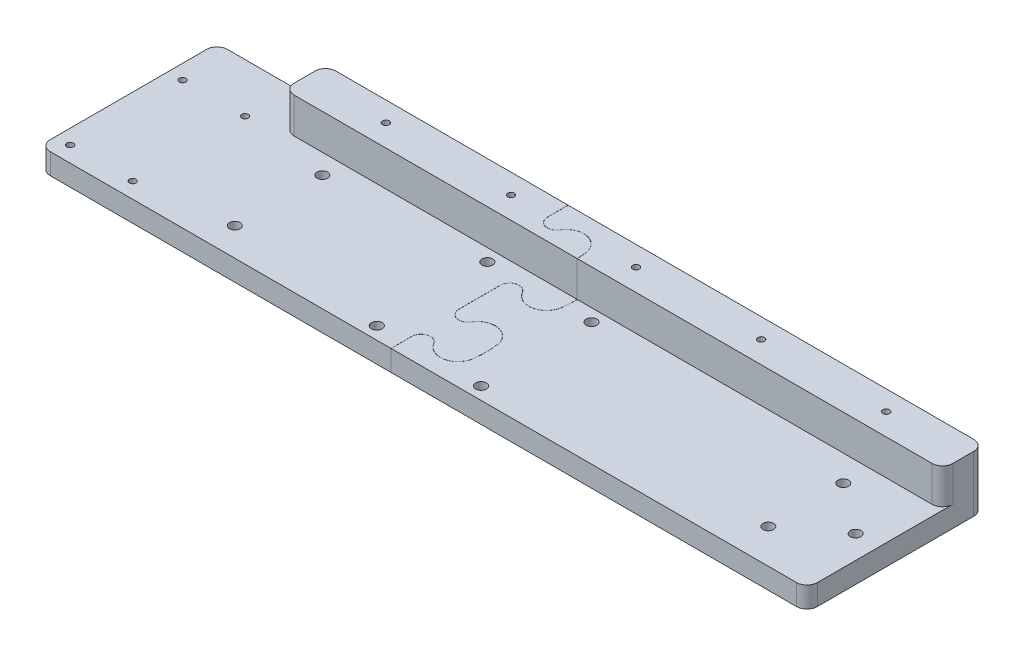
from build123d import *

# Parameters (mm, degrees)
SKETCH1_W                                    = 368
SKETCH1_H                                    = 85
BOSS_EXTRUDE1_DEPTH                          = 6
SKETCH2_W                                    = 316
SKETCH2_H                                    = 20
BOSS_EXTRUDE3_DEPTH                          = 17
CUT_EXTRUDE1_DEPTH                           = 379.071421824
CUT_EXTRUDE1_DEPTH_BACK                      = 379.071421824
SKETCH3_R                                    = 1.575
SKETCH3_R_2                                  = 2.55
SKETCH3_R_3                                  = 1.6
SKETCH4_W                                    = 368
SKETCH4_H                                    = 85
SKETCH4_R                                    = 3.575
SKETCH4_R_2                                  = 5.075
BOSS_EXTRUDE4_DEPTH                          = 4
FILLET1_R                                    = 5
WEIRD_CUT_DEPTH                              = 379.652875336
WEIRD_CUT_DEPTH_BACK                         = 379.652875336
IF_YOU_NO_STAY_I_MAKE_U_STAI_BREH_DEPTH      = 379.071421824
IF_YOU_NO_STAY_I_MAKE_U_STAI_BREH_DEPTH_BACK = 379.071421824
SKETCH8_R                                    = 2.575
YUH_DEPTH                                    = 379.652875336
YUH_DEPTH_BACK                               = 4
SKETCH9_R                                    = 5.075


with BuildPart() as part:
    # Sketch1 → Boss-Extrude1 (new body)
    with BuildSketch(Plane(origin=(0, 0, 0), x_dir=(1, 0, 0), z_dir=(0, 1, 0))):
        with Locations((184, 42.5)):
            Rectangle(SKETCH1_W, SKETCH1_H)
    extrude(amount=BOSS_EXTRUDE1_DEPTH)

    # Sketch2 → Boss-Extrude3 (add)
    with BuildSketch(Plane(origin=(0, 6, 0), x_dir=(1, 0, 0), z_dir=(0, 1, 0))):
        with Locations((210, 75)):
            Rectangle(SKETCH2_W, SKETCH2_H)
    extrude(amount=BOSS_EXTRUDE3_DEPTH)

    # Sketch3 → Cut-Extrude1 (cut, two sides: drawn at the far end of the back side and taken through both)
    with BuildSketch(Plane(origin=(0, 6, 0), x_dir=(1, 0, 0), z_dir=(0, 1, 0)).offset(-CUT_EXTRUDE1_DEPTH_BACK)):
        with Locations(Location((7, 61.45, 0), (0, 0, 270))):
            Circle(SKETCH3_R)
        with Locations(Location((7, 7.55, 0), (0, 0, 270))):
            Circle(SKETCH3_R)
        with Locations(Location((37, 7.55, 0), (0, 0, 270))):
            Circle(SKETCH3_R)
        with Locations(Location((37, 61.45, 0), (0, 0, 270))):
            Circle(SKETCH3_R)
        with Locations(Location((80, 55.5, 0), (0, 0, 270))):
            Circle(SKETCH3_R_2)
        with Locations(Location((80, 13.5, 0), (0, 0, 270))):
            Circle(SKETCH3_R_2)
        with Locations(Location((332.951144342, 52.487064273, 0), (0, 0, 270))):
            Circle(SKETCH3_R_2)
        with Locations(Location((356.848090273, 34.505122955, 0), (0, 0, 270))):
            Circle(SKETCH3_R_2)
        with Locations(Location((332.951144342, 16.523181637, 0), (0, 0, 270))):
            Circle(SKETCH3_R_2)
        with Locations(Location((90.5, 75.5, 0), (0, 0, 270))):
            Circle(SKETCH3_R_3)
        with Locations(Location((150.5, 75.5, 0), (0, 0, 270))):
            Circle(SKETCH3_R_3)
        with Locations(Location((210.5, 75.5, 0), (0, 0, 270))):
            Circle(SKETCH3_R_3)
        with Locations(Location((270.5, 75.5, 0), (0, 0, 270))):
            Circle(SKETCH3_R_3)
        with Locations(Location((330.5, 75.5, 0), (0, 0, 270))):
            Circle(SKETCH3_R_3)
    extrude(amount=CUT_EXTRUDE1_DEPTH + CUT_EXTRUDE1_DEPTH_BACK, mode=Mode.SUBTRACT)

    # Sketch4 → Boss-Extrude4 (add)
    with BuildSketch(Plane.XZ):
        with Locations((184, -42.5)):
            Rectangle(SKETCH4_W, SKETCH4_H)
        with Locations(Location((7, -7.55, 0), (0, 0, 270))):
            Circle(SKETCH4_R, mode=Mode.SUBTRACT)
        with Locations(Location((37, -7.55, 0), (0, 0, 270))):
            Circle(SKETCH4_R, mode=Mode.SUBTRACT)
        with Locations(Location((80, -13.5, 0), (0, 0, 270))):
            Circle(SKETCH4_R_2, mode=Mode.SUBTRACT)
        with Locations(Location((80, -55.5, 0), (0, 0, 270))):
            Circle(SKETCH4_R_2, mode=Mode.SUBTRACT)
        with Locations(Location((37, -61.45, 0), (0, 0, 270))):
            Circle(SKETCH4_R, mode=Mode.SUBTRACT)
        with Locations(Location((7, -61.45, 0), (0, 0, 270))):
            Circle(SKETCH4_R, mode=Mode.SUBTRACT)
        with Locations(Location((90.5, -75.5, 0), (0, 0, 270))):
            Circle(SKETCH4_R, mode=Mode.SUBTRACT)
        with Locations(Location((150.5, -75.5, 0), (0, 0, 270))):
            Circle(SKETCH4_R, mode=Mode.SUBTRACT)
        with Locations(Location((210.5, -75.5, 0), (0, 0, 270))):
            Circle(SKETCH4_R, mode=Mode.SUBTRACT)
        with Locations(Location((270.5, -75.5, 0), (0, 0, 270))):
            Circle(SKETCH4_R, mode=Mode.SUBTRACT)
        with Locations(Location((330.5, -75.5, 0), (0, 0, 270))):
            Circle(SKETCH4_R, mode=Mode.SUBTRACT)
        with Locations(Location((332.951144342, -52.487064273, 0), (0, 0, 270))):
            Circle(SKETCH4_R_2, mode=Mode.SUBTRACT)
        with Locations(Location((356.848090273, -34.505122955, 0), (0, 0, 270))):
            Circle(SKETCH4_R_2, mode=Mode.SUBTRACT)
        with Locations(Location((332.951144342, -16.523181637, 0), (0, 0, 270))):
            Circle(SKETCH4_R_2, mode=Mode.SUBTRACT)
    extrude(amount=BOSS_EXTRUDE4_DEPTH)

    # Fillet1
    fillet1_edges = [part.edges().sort_by_distance(p)[0] for p in [
        (52, 14.5, -85),
        (52, 14.5, -65),
        (368, 14.5, -65),
        (0, 1, -85),
        (368, 9.5, -85),
        (368, 1, 0),
        (0, 1, 0),
    ]]
    fillet(fillet1_edges, radius=FILLET1_R)

    # Sketch7 → Weird Cut (cut, two sides: drawn at the far end of the back side and taken through both)
    with BuildSketch(Plane.XZ.offset(4).offset(-WEIRD_CUT_DEPTH_BACK)):
        with BuildLine():
            Line((168.429742835, -9.968718608), (168.429742835, 0))
            Line((168.429742835, 0), (168.479742835, 0))
            Line((168.479742835, 0), (168.479742835, -9.968718608))
            ThreePointArc((168.479742835, -9.968718608), (171.739946469, -14.241172009), (176.721509375, -12.224536988))
            ThreePointArc((176.721509375, -12.224536988), (185.762309536, -8.235133349), (192.458717923, -15.502149495))
            ThreePointArc((192.458717923, -15.502149495), (192.814540004, -21.25), (192.458717923, -26.997850505))
            ThreePointArc((192.458717923, -26.997850505), (185.762309536, -34.264866651), (176.721509375, -30.275463012))
            ThreePointArc((176.721509375, -30.275463012), (171.739946469, -28.258827991), (168.479742835, -32.531281392))
            Line((168.479742835, -32.531281392), (168.479742835, -52.468718608))
            ThreePointArc((168.479742835, -52.468718608), (171.739946469, -56.741172009), (176.721509375, -54.724536988))
            ThreePointArc((176.721509375, -54.724536988), (185.762309536, -50.735133349), (192.458717923, -58.002149495))
            ThreePointArc((192.458717923, -58.002149495), (192.814540004, -63.75), (192.458717923, -69.497850505))
            ThreePointArc((192.458717923, -69.497850505), (185.762309536, -76.764866651), (176.721509375, -72.775463012))
            ThreePointArc((176.721509375, -72.775463012), (171.739946469, -70.758827991), (168.479742835, -75.031281392))
            Line((168.479742835, -75.031281392), (168.479742835, -85))
            Line((168.479742835, -85), (168.429742835, -85))
            Line((168.429742835, -85), (168.429742835, -75.031281392))
            ThreePointArc((168.429742835, -75.031281392), (171.726746686, -70.710601797), (176.764540004, -72.75))
            ThreePointArc((176.764540004, -72.75), (185.752114723, -76.715917026), (192.409099686, -69.491683614))
            ThreePointArc((192.409099686, -69.491683614), (192.764540004, -63.75), (192.409099686, -58.008316386))
            ThreePointArc((192.409099686, -58.008316386), (185.752114723, -50.784082974), (176.764540004, -54.75))
            ThreePointArc((176.764540004, -54.75), (171.726746686, -56.789398203), (168.429742835, -52.468718608))
            Line((168.429742835, -52.468718608), (168.429742835, -32.531281392))
            ThreePointArc((168.429742835, -32.531281392), (171.726746686, -28.210601797), (176.764540004, -30.25))
            ThreePointArc((176.764540004, -30.25), (185.752114723, -34.215917026), (192.409099686, -26.991683614))
            ThreePointArc((192.409099686, -26.991683614), (192.764540004, -21.25), (192.409099686, -15.508316386))
            ThreePointArc((192.409099686, -15.508316386), (185.752114723, -8.284082974), (176.764540004, -12.25))
            ThreePointArc((176.764540004, -12.25), (171.726746686, -14.289398203), (168.429742835, -9.968718608))
        make_face()
    extrude(amount=WEIRD_CUT_DEPTH + WEIRD_CUT_DEPTH_BACK, mode=Mode.SUBTRACT)


with BuildPart() as weird_cut_piece_1:
    # of the separate pieces the step leaves, piece 1, a body of its own (weird_cut_pieces)
    add(part.part.solids().sort_by_distance((168.479742835, -4, 0))[0])


with BuildPart() as weird_cut_piece_2:
    # of the separate pieces the step leaves, piece 2, a body of its own (weird_cut_pieces)
    add(part.part.solids().sort_by_distance((5, 6, 0))[0])


with BuildPart() as if_you_no_stay_i_make_u_stai_breh_tool:
    # Sketch8 → If you no stay i make u stai breh (new, two sides: drawn at the far end of the back side and taken through both)
    with BuildSketch(Plane(origin=(0, 6, 0), x_dir=(1, 0, 0), z_dir=(0, 1, 0)).offset(-IF_YOU_NO_STAY_I_MAKE_U_STAI_BREH_DEPTH_BACK)):
        with Locations(Location((205.64714142, 59, 0), (0, 0, 90))):
            Circle(SKETCH8_R)
        with Locations(Location((155.64714142, 59, 0), (0, 0, 90))):
            Circle(SKETCH8_R)
        with Locations(Location((205.64714142, 6, 0), (0, 0, 90))):
            Circle(SKETCH8_R)
        with Locations(Location((155.64714142, 6, 0), (0, 0, 90))):
            Circle(SKETCH8_R)
    extrude(amount=IF_YOU_NO_STAY_I_MAKE_U_STAI_BREH_DEPTH + IF_YOU_NO_STAY_I_MAKE_U_STAI_BREH_DEPTH_BACK)


with BuildPart() as weird_cut_piece_1_1:
    add(weird_cut_piece_1.part)

    # If you no stay i make u stai breh: cut by if_you_no_stay_i_make_u_stai_breh_tool
    add(if_you_no_stay_i_make_u_stai_breh_tool.part, mode=Mode.SUBTRACT)


with BuildPart() as weird_cut_piece_2_1:
    add(weird_cut_piece_2.part)

    # If you no stay i make u stai breh: cut by if_you_no_stay_i_make_u_stai_breh_tool
    add(if_you_no_stay_i_make_u_stai_breh_tool.part, mode=Mode.SUBTRACT)


with BuildPart() as yuh_tool:
    # Sketch9 → yuh (new, two sides: drawn at the far end of the back side and taken through both)
    with BuildSketch(Plane.XZ.offset(4).offset(-YUH_DEPTH_BACK)):
        with Locations(Location((155.64714142, -6, 0), (0, 0, 270))):
            Circle(SKETCH9_R)
        with Locations(Location((205.64714142, -6, 0), (0, 0, 270))):
            Circle(SKETCH9_R)
        with Locations(Location((205.64714142, -59, 0), (0, 0, 270))):
            Circle(SKETCH9_R)
        with Locations(Location((155.64714142, -59, 0), (0, 0, 270))):
            Circle(SKETCH9_R)
    extrude(amount=YUH_DEPTH + YUH_DEPTH_BACK)


with BuildPart() as weird_cut_piece_1_2:
    add(weird_cut_piece_1_1.part)

    # yuh: cut by yuh_tool
    add(yuh_tool.part, mode=Mode.SUBTRACT)


with BuildPart() as weird_cut_piece_2_2:
    add(weird_cut_piece_2_1.part)

    # yuh: cut by yuh_tool
    add(yuh_tool.part, mode=Mode.SUBTRACT)


solid = Compound([weird_cut_piece_1_2.part, weird_cut_piece_2_2.part])
